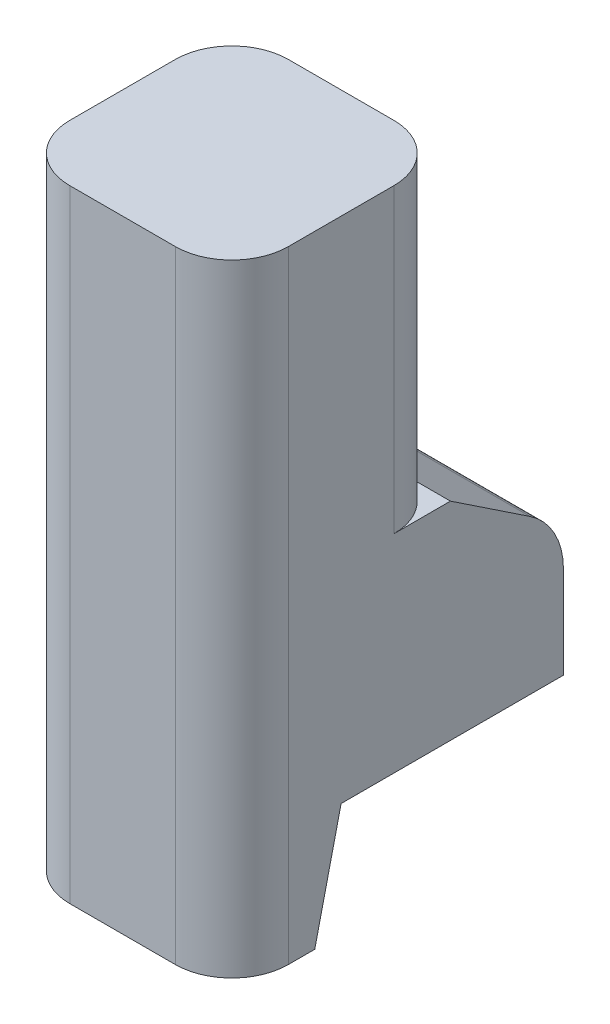
from build123d import *

# Parameters (mm, degrees)
SKETCH_2_W               = 5.8
SKETCH_2_H               = 8.8
EXTRUDE_1_DEPTH          = 16.5
SKETCH_3_W               = 5.8
SKETCH_3_H               = 5.9
CUT_EXTRUDE_1_DEPTH      = 3
SKETCH_4_R               = 1.75
CUT_EXTRUDE_2_DEPTH      = 2.5
SKETCH_5_W               = 5.8
SKETCH_5_H               = 3
CUT_EXTRUDE_3_DEPTH      = 8
FILLET_1_R               = 1.5
CUT_EXTRUDE_4_DEPTH      = 19.426339843
CUT_EXTRUDE_4_DEPTH_BACK = 19.426339843
FILLET_2_R               = 2
CUT_EXTRUDE_5_DEPTH      = 19.426339843
CUT_EXTRUDE_5_DEPTH_BACK = 19.426339843


with BuildPart() as part:
    # ｽｹｯﾁ2 → ﾎﾞｽ - 押し出し1 (new body)
    with BuildSketch(Plane(origin=(0, 0, 0), x_dir=(1, 0, 0), z_dir=(0, 1, 0))):
        with Locations((2.9, 1.4)):
            Rectangle(SKETCH_2_W, SKETCH_2_H)
    extrude(amount=EXTRUDE_1_DEPTH)

    # ｽｹｯﾁ3 → ｶｯﾄ - 押し出し1 (cut)
    with BuildSketch(Plane.XZ):
        with Locations((2.9, -2.85)):
            Rectangle(SKETCH_3_W, SKETCH_3_H)
    extrude(amount=-CUT_EXTRUDE_1_DEPTH, mode=Mode.SUBTRACT)

    # ｽｹｯﾁ4 → ｶｯﾄ - 押し出し2 (cut)
    with BuildSketch(Plane.XZ.offset(-3)):
        with Locations(Location((2.9, -2.9, 0), (0, 0, 270))):
            Circle(SKETCH_4_R)
    extrude(amount=-CUT_EXTRUDE_2_DEPTH, mode=Mode.SUBTRACT)

    # ｽｹｯﾁ5 → ｶｯﾄ - 押し出し3 (cut)
    with BuildSketch(Plane(origin=(0, 16.5, 0), x_dir=(1, 0, 0), z_dir=(0, 1, 0))):
        with Locations((2.9, 4.3)):
            Rectangle(SKETCH_5_W, SKETCH_5_H)
    extrude(amount=-CUT_EXTRUDE_3_DEPTH, mode=Mode.SUBTRACT)

    # ﾌｨﾚｯﾄ1
    fillet_1_edges = [part.edges().sort_by_distance(p)[0] for p in [
        (0, 12.5, -2.8),
        (5.8, 12.5, -2.8),
        (5.8, 8.25, 3),
        (0, 8.25, 3),
    ]]
    fillet(fillet_1_edges, radius=FILLET_1_R)

    # ｽｹｯﾁ9 → ｶｯﾄ - 押し出し4 (cut, two sides: drawn at the far end of the back side and taken through both)
    with BuildSketch(Plane(origin=(5.8, 0, 0), x_dir=(0, 0, -1), z_dir=(1, 0, 0)).offset(-CUT_EXTRUDE_4_DEPTH_BACK)):
        Polygon((5.8, 8.5), (2.8, 8.5), (5.8, 6.5), align=None)
    extrude(amount=CUT_EXTRUDE_4_DEPTH + CUT_EXTRUDE_4_DEPTH_BACK, mode=Mode.SUBTRACT)

    # ﾌｨﾚｯﾄ2
    fillet_2_edges = [part.edges().sort_by_distance(p)[0] for p in [
        (2.9, 6.5, -5.8),
    ]]
    fillet(fillet_2_edges, radius=FILLET_2_R)

    # ｽｹｯﾁ10 → ｶｯﾄ - 押し出し5 (cut, two sides: drawn at the far end of the back side and taken through both)
    with BuildSketch(Plane(origin=(5.8, 0, 0), x_dir=(0, 0, -1), z_dir=(1, 0, 0)).offset(-CUT_EXTRUDE_5_DEPTH_BACK)):
        Polygon((-0.1, 0), (-0.1, 3), (-0.8, 0), align=None)
    extrude(amount=CUT_EXTRUDE_5_DEPTH + CUT_EXTRUDE_5_DEPTH_BACK, mode=Mode.SUBTRACT)


solid = part.part
